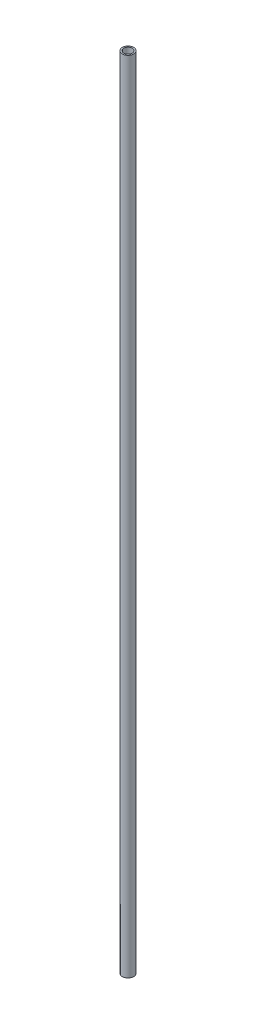
from build123d import *

# Parameters (mm, degrees)
SKETCH1_R           = 1
SKETCH1_R_2         = 0.75
BOSS_EXTRUDE1_DEPTH = 140


with BuildPart() as part:
    # Sketch1 → Boss-Extrude1 (new body)
    with BuildSketch(Plane(origin=(0, 0, 0), x_dir=(1, 0, 0), z_dir=(0, 1, 0))):
        with Locations(Location((0, 0, 0), (0, 0, 270))):
            Circle(SKETCH1_R)
        with Locations(Location((0, 0, 0), (0, 0, 270))):
            Circle(SKETCH1_R_2, mode=Mode.SUBTRACT)
    extrude(amount=BOSS_EXTRUDE1_DEPTH)


solid = part.part
